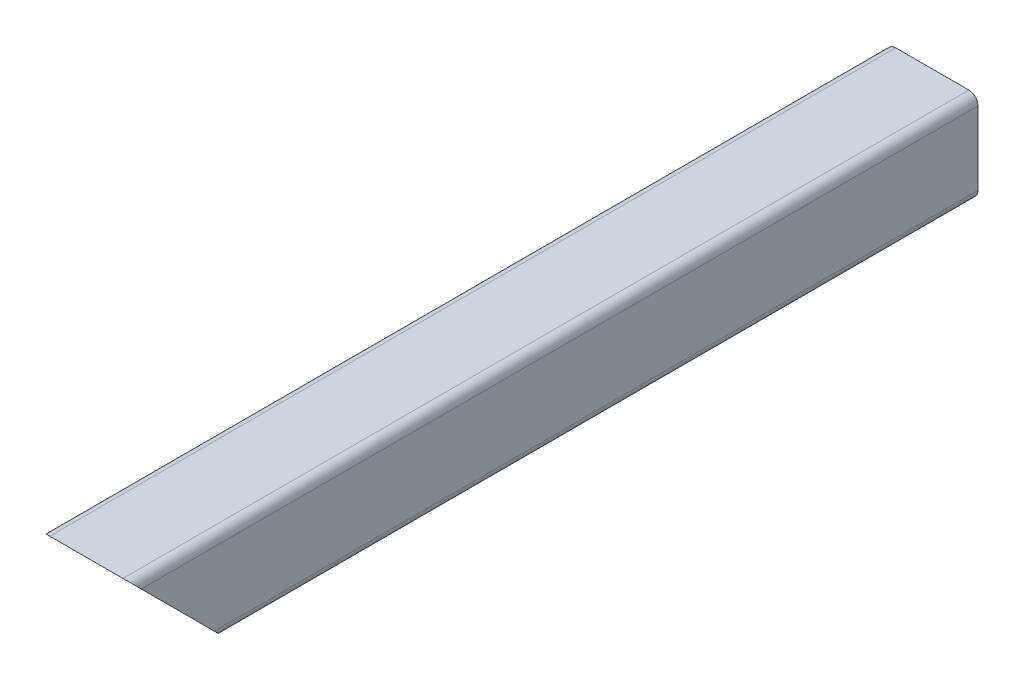
from build123d import *

# Parameters (mm, degrees)
Y_KSEKLIK_EKSTR_ZYON1_DEPTH = 370
KES_EKSTR_ZYON1_DEPTH       = 41
KES_EKSTR_ZYON1_DEPTH_BACK  = 43


with BuildPart() as part:
    # Çizim1 → Yükseklik-Ekstrüzyon1 (new body)
    with BuildSketch(Plane.XY):
        with BuildLine():
            Line((-16, 20), (16, 20))
            ThreePointArc((16, 20), (18.828427125, 18.828427125), (20, 16))
            Line((20, 16), (20, -16))
            ThreePointArc((20, -16), (18.828427125, -18.828427125), (16, -20))
            Line((16, -20), (-16, -20))
            ThreePointArc((-16, -20), (-18.828427125, -18.828427125), (-20, -16))
            Line((-20, -16), (-20, 16))
            ThreePointArc((-20, 16), (-18.828427125, 18.828427125), (-16, 20))
        make_face()
        with BuildLine():
            Line((-18, 16), (-18, -16))
            ThreePointArc((-18, -16), (-17.414213562, -17.414213562), (-16, -18))
            Line((-16, -18), (16, -18))
            ThreePointArc((16, -18), (17.414213562, -17.414213562), (18, -16))
            Line((18, -16), (18, 16))
            ThreePointArc((18, 16), (17.414213562, 17.414213562), (16, 18))
            Line((16, 18), (-16, 18))
            ThreePointArc((-16, 18), (-17.414213562, 17.414213562), (-18, 16))
        make_face(mode=Mode.SUBTRACT)
    extrude(amount=Y_KSEKLIK_EKSTR_ZYON1_DEPTH)

    # Çizim3 → Kes-Ekstrüzyon1 (cut, two sides: drawn at the far end of the back side and taken through both)
    with BuildSketch(Plane(origin=(0, 0, 0), x_dir=(0, 0, -1), z_dir=(1, 0, 0)).offset(-KES_EKSTR_ZYON1_DEPTH_BACK)):
        Polygon((-370, 20), (-330, -20), (-370, -20), align=None)
    extrude(amount=KES_EKSTR_ZYON1_DEPTH + KES_EKSTR_ZYON1_DEPTH_BACK, mode=Mode.SUBTRACT)


solid = part.part
